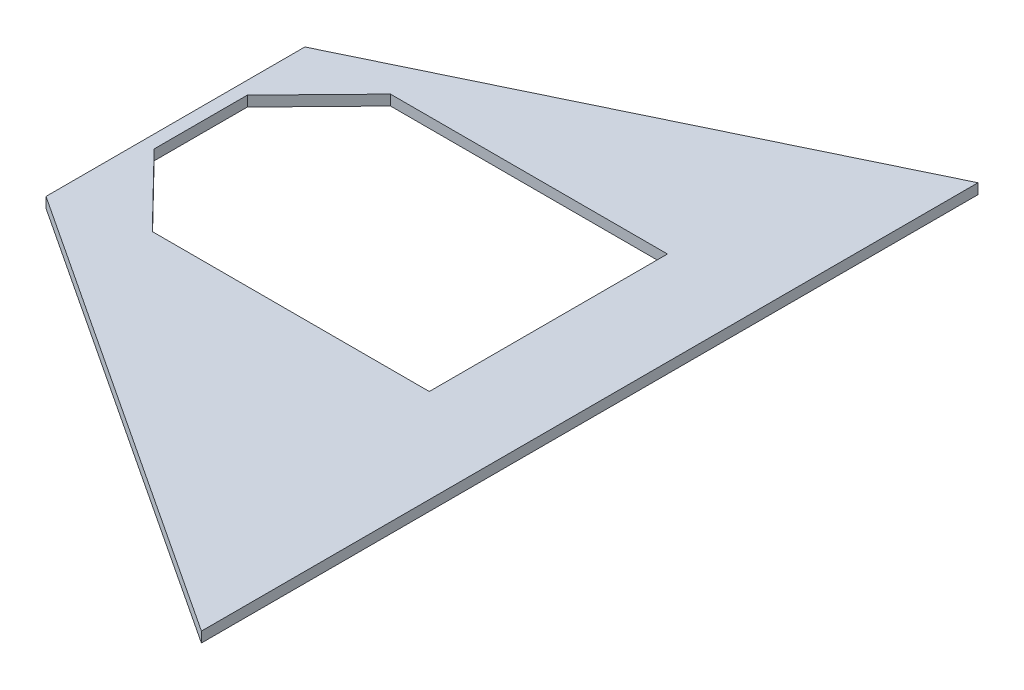
from build123d import *

# Parameters (mm, degrees)
EXTRUDE_2_DEPTH = 4


with BuildPart() as part:
    # Sketch 1 → Бобышка-Вытянуть2 (new body)
    with BuildSketch(Plane(origin=(9.520291442, 10, -132.987365348), x_dir=(0, 0, 1), z_dir=(0, -1, 0))):
        Polygon((0, 0), (300, 0), (184.59311112, 175.445860593), (84.59311112, 175.445860593), align=None)
        Polygon((83.826194839, 143.144403483), (83.826194839, 36.144403483), (175.826194839, 36.144403483), (175.826194839, 143.144403483), (147.826194839, 170.445860593), (111.826194839, 170.445860593), align=None, mode=Mode.SUBTRACT)
    extrude(amount=-EXTRUDE_2_DEPTH)


solid = part.part
